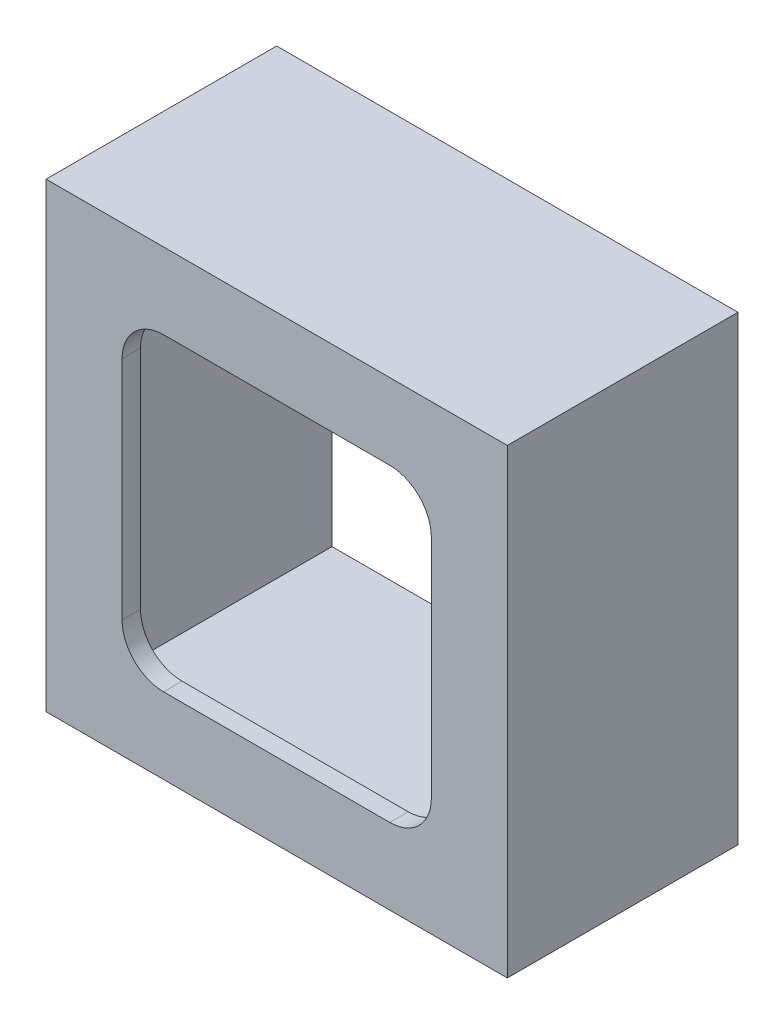
from build123d import *

# Parameters (mm, degrees)
SKETCH1_W           = 50
SKETCH1_H           = 50
BOSS_EXTRUDE1_DEPTH = 2
SKETCH2_W           = 50
SKETCH2_H           = 50
SKETCH2_W_2         = 38
SKETCH2_H_2         = 38
BOSS_EXTRUDE2_DEPTH = 23


with BuildPart() as part:
    # Sketch1 → Boss-Extrude1 (new body)
    with BuildSketch(Plane.XY):
        Rectangle(SKETCH1_W, SKETCH1_H)
        with BuildLine():
            Line((12.263455967, 16.763455967), (-12.263455967, 16.763455967))
            ThreePointArc((-12.263455967, 16.763455967), (-15.445436483, 15.445436483), (-16.763455967, 12.263455967))
            Line((-16.763455967, 12.263455967), (-16.763455967, -12.263455967))
            ThreePointArc((-16.763455967, -12.263455967), (-15.445436483, -15.445436483), (-12.263455967, -16.763455967))
            Line((-12.263455967, -16.763455967), (12.263455967, -16.763455967))
            ThreePointArc((12.263455967, -16.763455967), (15.445436483, -15.445436483), (16.763455967, -12.263455967))
            Line((16.763455967, -12.263455967), (16.763455967, 12.263455967))
            ThreePointArc((16.763455967, 12.263455967), (15.445436483, 15.445436483), (12.263455967, 16.763455967))
        make_face(mode=Mode.SUBTRACT)
    extrude(amount=-BOSS_EXTRUDE1_DEPTH)

    # Sketch2 → Boss-Extrude2 (add)
    with BuildSketch(Plane(origin=(0, 0, -2), x_dir=(-1, 0, 0), z_dir=(0, 0, -1))):
        Rectangle(SKETCH2_W, SKETCH2_H)
        Rectangle(SKETCH2_W_2, SKETCH2_H_2, mode=Mode.SUBTRACT)
    extrude(amount=BOSS_EXTRUDE2_DEPTH)


solid = part.part
